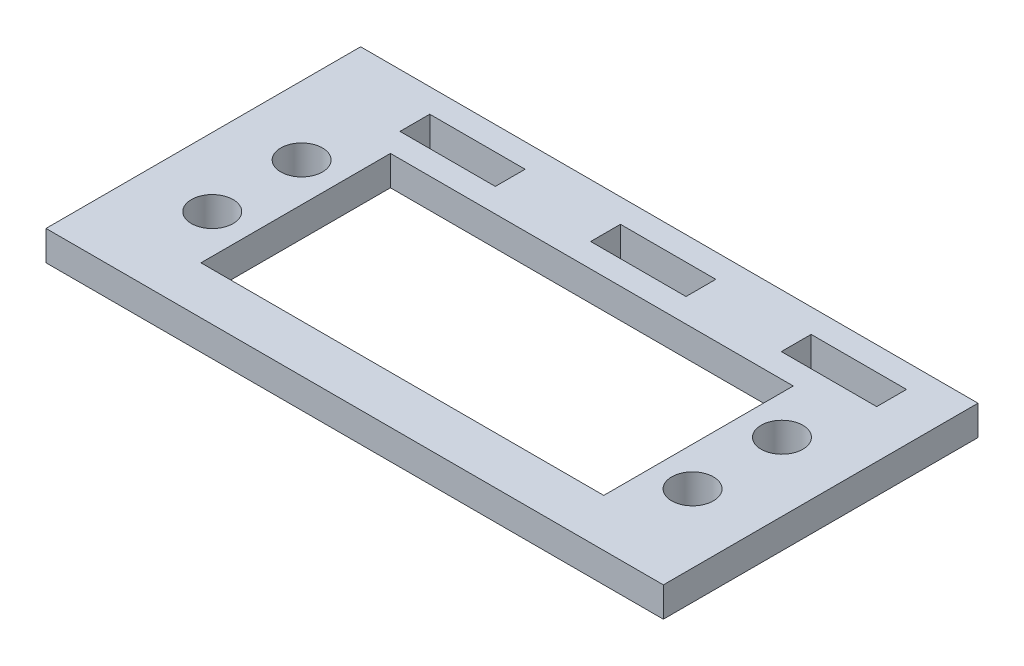
from build123d import *

# Parameters (mm, degrees)
SKETCH1_W           = 65.786
SKETCH1_H           = 33.528
SKETCH1_R           = 2.2225
SKETCH1_W_2         = 10.16
SKETCH1_H_2         = 3.175
SKETCH1_W_3         = 42.926
SKETCH1_H_3         = 20.193
BOSS_EXTRUDE2_DEPTH = 3.175


with BuildPart() as part:
    # Sketch1 → Boss-Extrude2 (new body)
    with BuildSketch(Plane(origin=(0, 0, 0), x_dir=(1, 0, 0), z_dir=(0, 1, 0))):
        with Locations((0, 1.5875)):
            Rectangle(SKETCH1_W, SKETCH1_H)
        with Locations(Location((-25.5905, 4.7625, 0), (0, 0, 270))):
            Circle(SKETCH1_R, mode=Mode.SUBTRACT)
        with Locations(Location((-25.5905, -4.7625, 0), (0, 0, 270))):
            Circle(SKETCH1_R, mode=Mode.SUBTRACT)
        with Locations(Location((25.5905, 4.7625, 0), (0, 0, 270))):
            Circle(SKETCH1_R, mode=Mode.SUBTRACT)
        with Locations(Location((25.5905, -4.7625, 0), (0, 0, 270))):
            Circle(SKETCH1_R, mode=Mode.SUBTRACT)
        with Locations((22.733, 14.224)):
            Rectangle(SKETCH1_W_2, SKETCH1_H_2, mode=Mode.SUBTRACT)
        with Locations((2.413, 14.224)):
            Rectangle(SKETCH1_W_2, SKETCH1_H_2, mode=Mode.SUBTRACT)
        with Locations((-17.907, 14.224)):
            Rectangle(SKETCH1_W_2, SKETCH1_H_2, mode=Mode.SUBTRACT)
        Rectangle(SKETCH1_W_3, SKETCH1_H_3, mode=Mode.SUBTRACT)
    extrude(amount=BOSS_EXTRUDE2_DEPTH)


solid = part.part
